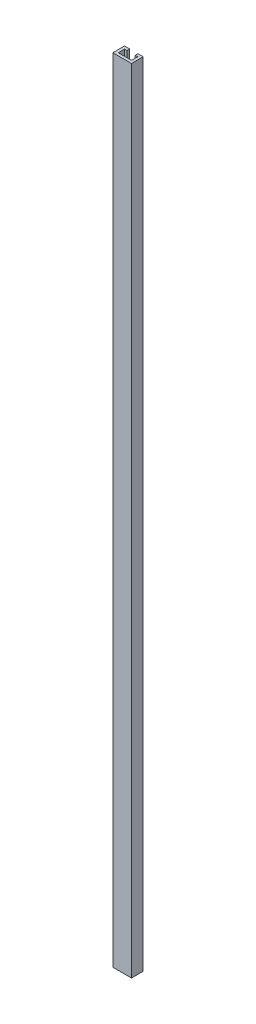
from build123d import *

# Parameters (mm, degrees)
EXTRUDE_1_DEPTH = 340


with BuildPart() as part:
    # 草图1 → 凸台-拉伸1 (new body)
    with BuildSketch(Plane(origin=(0, 0, 0), x_dir=(1, 0, 0), z_dir=(0, 1, 0))):
        Polygon((0, -5), (8, -5), (8, 0), (5.75, 0), (5.75, -1.15), (6.85, -1.15), (6.85, -3.85), (1.15, -3.85), (1.15, -1.15), (2.25, -1.15), (2.25, 0), (0, 0), align=None)
    extrude(amount=EXTRUDE_1_DEPTH)


solid = part.part
